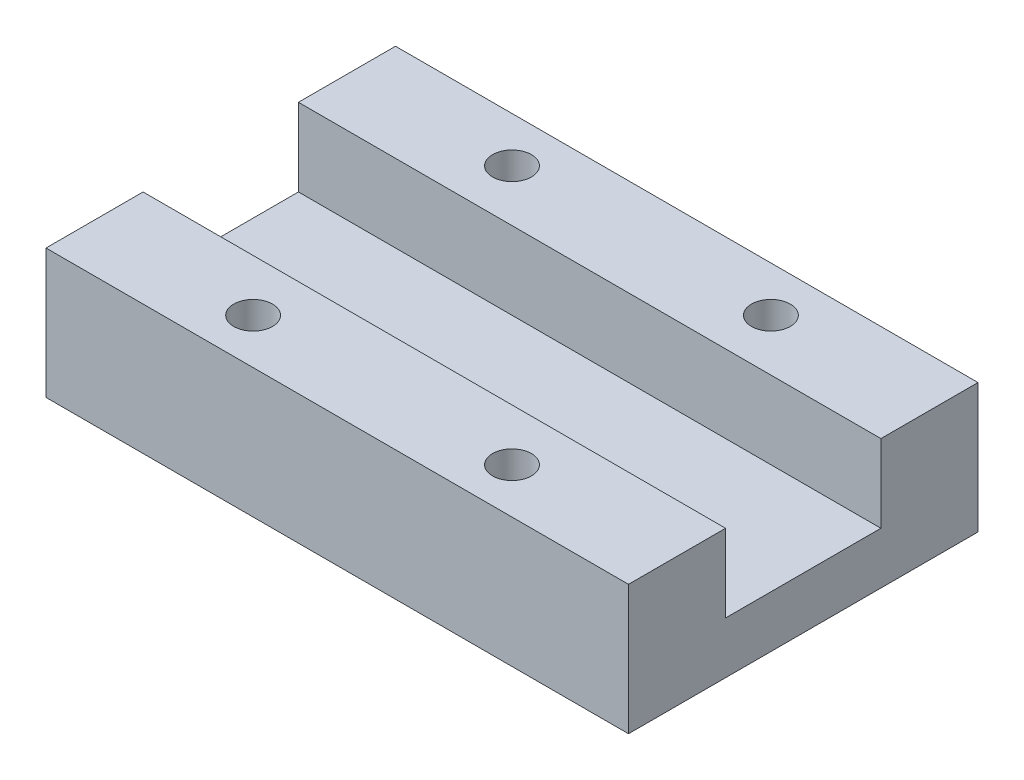
from build123d import *

# Parameters (mm, degrees)
BOSS_EXTRUDE1_DEPTH = 45
CUT_EXTRUDE1_DEPTH  = 45


with BuildPart() as part:
    # Sketch1 → Boss-Extrude1 (new body)
    with BuildSketch(Plane(origin=(0, 0, 0), x_dir=(0, 0, -1), z_dir=(1, 0, 0))):
        Polygon((0, 0), (27, 0), (27, 10), (19.5, 10), (19.5, 4), (7.5, 4), (7.5, 10), (0, 10), align=None)
    extrude(amount=BOSS_EXTRUDE1_DEPTH)

    # Sketch2 → Cut-Extrude1 (cut)
    with BuildSketch(Plane.XZ):
        with BuildLine():
            ThreePointArc((31, -3.5), (31.439339828, -4.560660172), (32.5, -5))
            Line((32.5, -5), (32.5, -3.5))
            Line((32.5, -3.5), (31, -3.5))
        make_face()
        with BuildLine():
            Line((32.5, -3.5), (32.5, -5))
            ThreePointArc((32.5, -5), (33.560660172, -4.560660172), (34, -3.5))
            ThreePointArc((34, -3.5), (32.5, -2), (31, -3.5))
            Line((31, -3.5), (32.5, -3.5))
        make_face()
        with BuildLine():
            ThreePointArc((32.5, -22), (31.439339828, -22.439339828), (31, -23.5))
            Line((31, -23.5), (32.5, -23.5))
            Line((32.5, -23.5), (32.5, -22))
        make_face()
        with BuildLine():
            Line((32.5, -23.5), (31, -23.5))
            ThreePointArc((31, -23.5), (32.5, -25), (34, -23.5))
            ThreePointArc((34, -23.5), (33.560660172, -22.439339828), (32.5, -22))
            Line((32.5, -22), (32.5, -23.5))
        make_face()
        with BuildLine():
            Line((12.5, -22), (12.5, -23.5))
            Line((12.5, -23.5), (14, -23.5))
            ThreePointArc((14, -23.5), (13.560660172, -22.439339828), (12.5, -22))
        make_face()
        with BuildLine():
            Line((14, -23.5), (12.5, -23.5))
            Line((12.5, -23.5), (12.5, -22))
            ThreePointArc((12.5, -22), (11.439339828, -24.560660172), (14, -23.5))
        make_face()
        with BuildLine():
            ThreePointArc((14, -3.5), (11.439339828, -2.439339828), (12.5, -5))
            Line((12.5, -5), (12.5, -3.5))
            Line((12.5, -3.5), (14, -3.5))
        make_face()
        with BuildLine():
            Line((12.5, -3.5), (12.5, -5))
            ThreePointArc((12.5, -5), (13.560660172, -4.560660172), (14, -3.5))
            Line((14, -3.5), (12.5, -3.5))
        make_face()
    extrude(amount=-CUT_EXTRUDE1_DEPTH, mode=Mode.SUBTRACT)


solid = part.part
